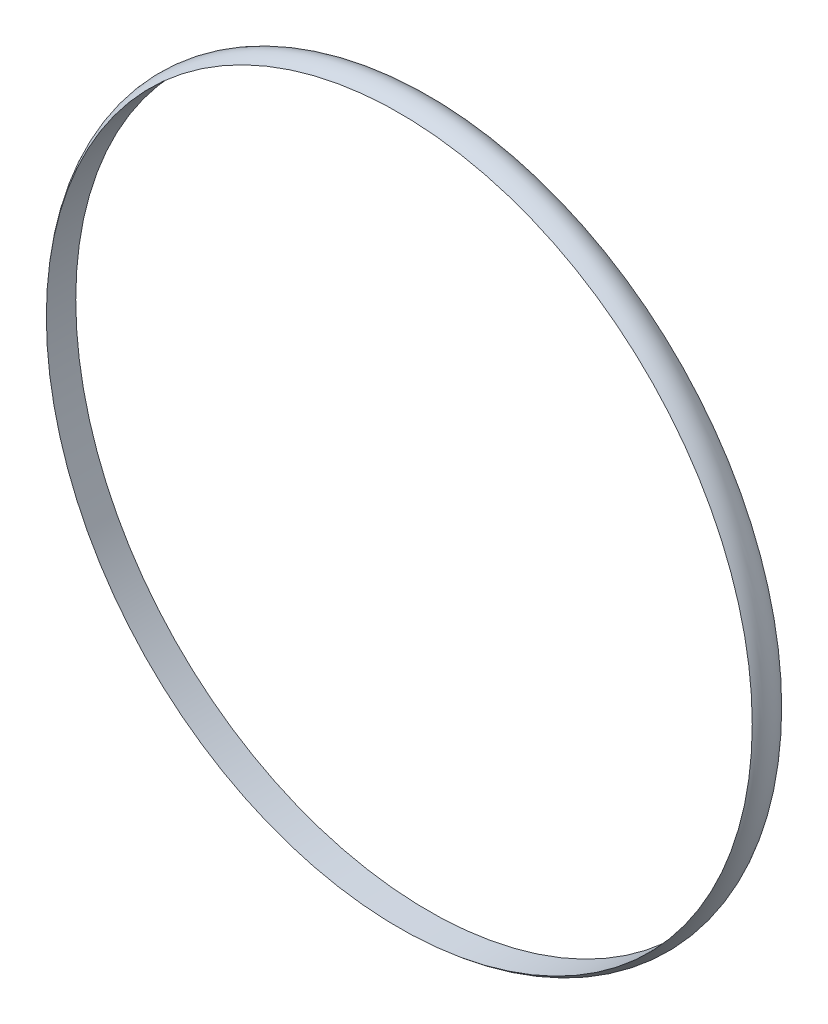
from build123d import *


with BuildPart() as part:
    # Sketch1 → Revolve1 (revolve)
    with BuildSketch(Plane(origin=(0, 0, 0), x_dir=(0, 0, -1), z_dir=(1, 0, 0)), mode=Mode.PRIVATE) as revolve1_sk:
        with BuildLine():
            ThreePointArc((-4.8, 115.22), (0, 117.179300256), (4.8, 115.22))
            Line((4.8, 115.22), (-4.8, 115.22))
        make_face()
    revolve(revolve1_sk.sketch.rotate(Axis((0, 0, 12.444377479), (0, 0, -1)), 90), axis=Axis((0, 0, 12.444377479), (0, 0, -1)))


solid = part.part
